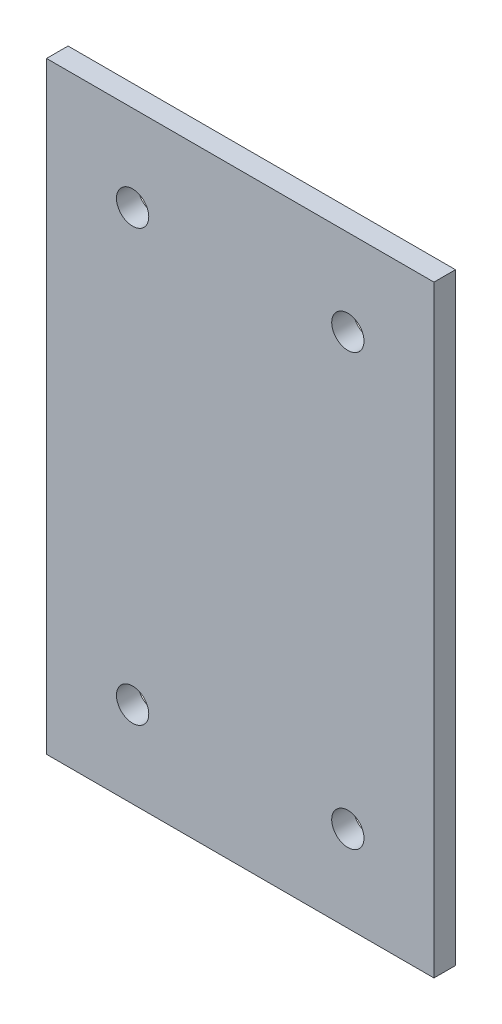
from build123d import *

# Parameters (mm, degrees)
SKETCH_1_W      = 36
SKETCH_1_H      = 56
SKETCH_1_R      = 1.5
EXTRUDE_1_DEPTH = 2


with BuildPart() as part:
    # Эскиз1 → Бобышка-Вытянуть1 (new body)
    with BuildSketch(Plane.XY):
        with Locations((18, 28)):
            Rectangle(SKETCH_1_W, SKETCH_1_H)
        with Locations((8, 8)):
            Circle(SKETCH_1_R, mode=Mode.SUBTRACT)
        with Locations((28, 8)):
            Circle(SKETCH_1_R, mode=Mode.SUBTRACT)
        with Locations((28, 48)):
            Circle(SKETCH_1_R, mode=Mode.SUBTRACT)
        with Locations((8, 48)):
            Circle(SKETCH_1_R, mode=Mode.SUBTRACT)
    extrude(amount=EXTRUDE_1_DEPTH)


solid = part.part
